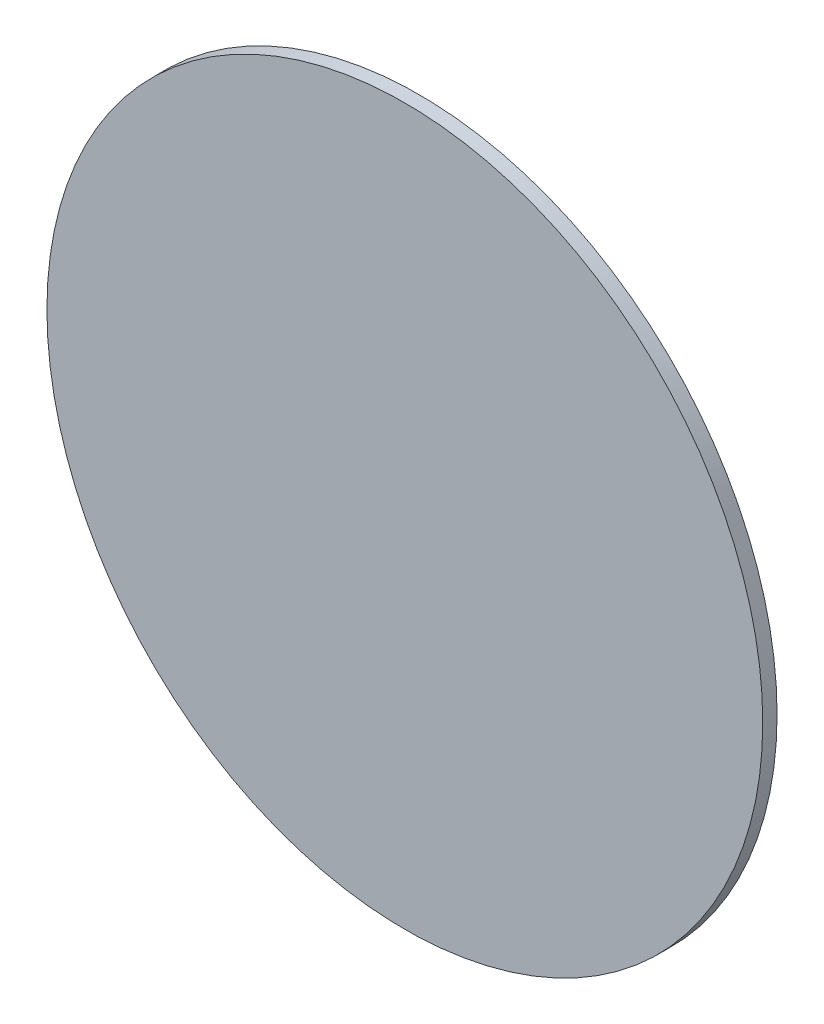
from build123d import *

# Parameters (mm, degrees)
SKETCH1_R           = 12.5
BOSS_EXTRUDE1_DEPTH = 0.5


with BuildPart() as part:
    # Sketch1 → Boss-Extrude1 (new body)
    with BuildSketch(Plane.XY):
        Circle(SKETCH1_R)
    extrude(amount=BOSS_EXTRUDE1_DEPTH)


solid = part.part
